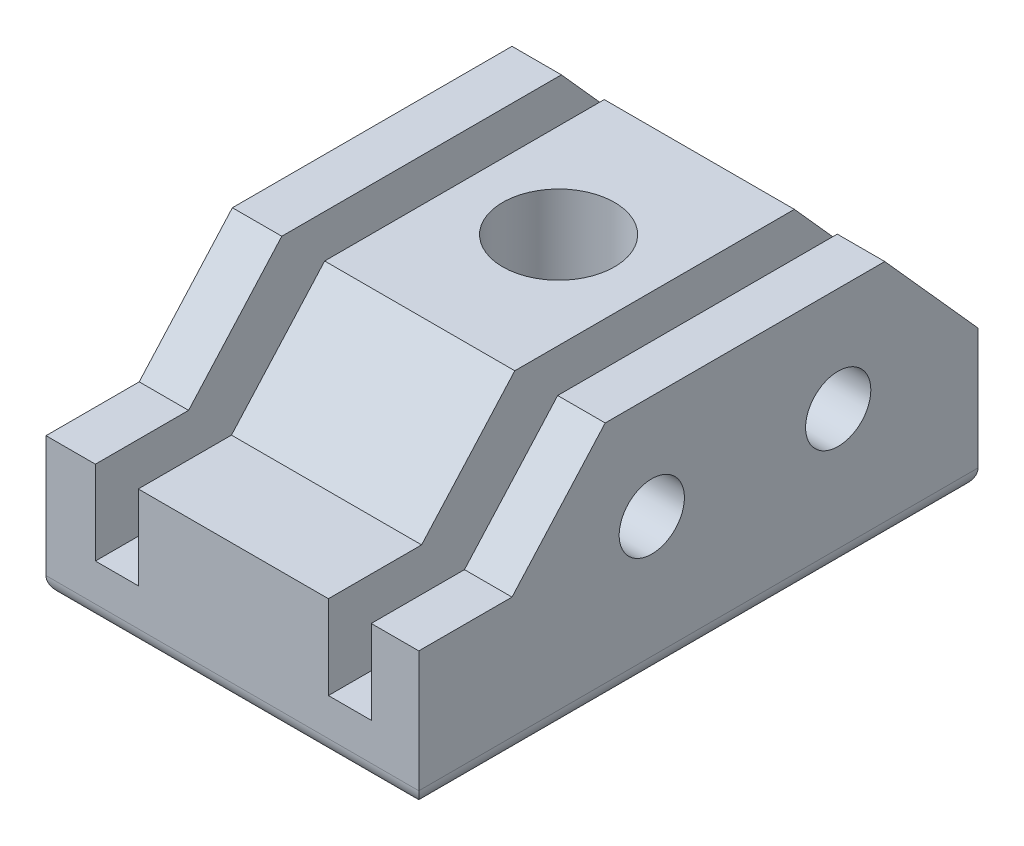
from build123d import *

# Parameters (mm, degrees)
SKETCH1_W           = 63.5
SKETCH1_H           = 6.35
BOSS_EXTRUDE1_DEPTH = 50.8
BOSS_EXTRUDE2_DEPTH = 50.8
SKETCH10_W          = 5.842
SKETCH10_H          = 25.629031657
CUT_EXTRUDE1_DEPTH  = 88.854357354
LPATTERN3_COUNT     = 2
LPATTERN3_PITCH     = 31.75
SKETCH11_R          = 4.445
CUT_EXTRUDE2_DEPTH  = 88.854357354
BOSS_EXTRUDE3_DEPTH = 12.7
SKETCH23_R          = 7.62
CUT_EXTRUDE6_DEPTH  = 88.854357354
FILLET2_R           = 2.54
SKETCH24_R          = 3.175
CUT_EXTRUDE7_DEPTH  = 10


with BuildPart() as part:
    # Sketch1 → Boss-Extrude1 (new body)
    with BuildSketch(Plane(origin=(0, 0, 0), x_dir=(0, 0, -1), z_dir=(1, 0, 0))):
        with Locations((31.75, 3.175)):
            Rectangle(SKETCH1_W, SKETCH1_H)
    extrude(amount=-BOSS_EXTRUDE1_DEPTH)

    # Sketch2 → Boss-Extrude2 (add)
    with BuildSketch(Plane(origin=(0, 0, 0), x_dir=(0, 0, -1), z_dir=(1, 0, 0))):
        Polygon((0, 6.35), (0, 19.05), (12.7, 33.249031657), (50.8, 33.249031657), (63.5, 19.05), (63.5, 6.35), align=None)
    extrude(amount=-BOSS_EXTRUDE2_DEPTH)

    # Sketch10 → Cut-Extrude1 (cut, through all)
    with BuildSketch(Plane(origin=(0, 0, -63.5), x_dir=(-1, 0, 0), z_dir=(0, 0, -1))):
        with Locations((9.398, 20.434515829)):
            Rectangle(SKETCH10_W, SKETCH10_H)
    cut_extrude1 = extrude(amount=-CUT_EXTRUDE1_DEPTH, mode=Mode.SUBTRACT)

    # LPattern3: Cut-Extrude1 ×2
    with Locations(*[(-i * LPATTERN3_PITCH, 0, 0) for i in range(1, LPATTERN3_COUNT)]):
        add(cut_extrude1, mode=Mode.SUBTRACT)

    # Sketch11 → Cut-Extrude2 (cut, through all)
    with BuildSketch(Plane(origin=(0, 0, 0), x_dir=(0, 0, -1), z_dir=(1, 0, 0))):
        with Locations((19.05, 19.05)):
            Circle(SKETCH11_R)
        with Locations((44.45, 19.05)):
            Circle(SKETCH11_R)
    extrude(amount=-CUT_EXTRUDE2_DEPTH, mode=Mode.SUBTRACT)

    # Sketch22 → Boss-Extrude3 (add)
    with BuildSketch(Plane.XY):
        Polygon((0, 0), (-50.8, 0), (-50.8, 7.62), (-50.8, 19.05), (-44.069, 19.05), (-44.069, 7.62), (-38.227, 7.62), (-38.227, 19.05), (-12.319, 19.05), (-12.319, 7.62), (-6.477, 7.62), (-6.477, 19.05), (0, 19.05), (0, 7.62), align=None)
    extrude(amount=BOSS_EXTRUDE3_DEPTH)

    # Sketch23 → Cut-Extrude6 (cut, through all)
    with BuildSketch(Plane(origin=(0, 33.249031657, 0), x_dir=(1, 0, 0), z_dir=(0, 1, 0))):
        with Locations(Location((-25.4, 31.75, 0), (0, 0, 270))):
            Circle(SKETCH23_R)
    extrude(amount=-CUT_EXTRUDE6_DEPTH, mode=Mode.SUBTRACT)

    # Fillet2
    fillet2_edges = [part.edges().sort_by_distance(p)[0] for p in [
        (-25.4, 0, 12.7),
        (0, 0, -25.4),
        (-50.8, 0, -25.4),
        (-25.4, 0, -63.5),
    ]]
    fillet(fillet2_edges, radius=FILLET2_R)

    # Sketch24 → Cut-Extrude7 (cut)
    with BuildSketch(Plane.XZ):
        with Locations(Location((-30.4, -46.15, 0), (0, 0, 270))):
            Circle(SKETCH24_R)
        with Locations(Location((-20.4, -46.15, 0), (0, 0, 270))):
            Circle(SKETCH24_R)
        with Locations(Location((-20.4, 3.35, 0), (0, 0, 270))):
            Circle(SKETCH24_R)
        with Locations(Location((-30.4, 3.35, 0), (0, 0, 270))):
            Circle(SKETCH24_R)
    extrude(amount=-CUT_EXTRUDE7_DEPTH, mode=Mode.SUBTRACT)


solid = part.part
